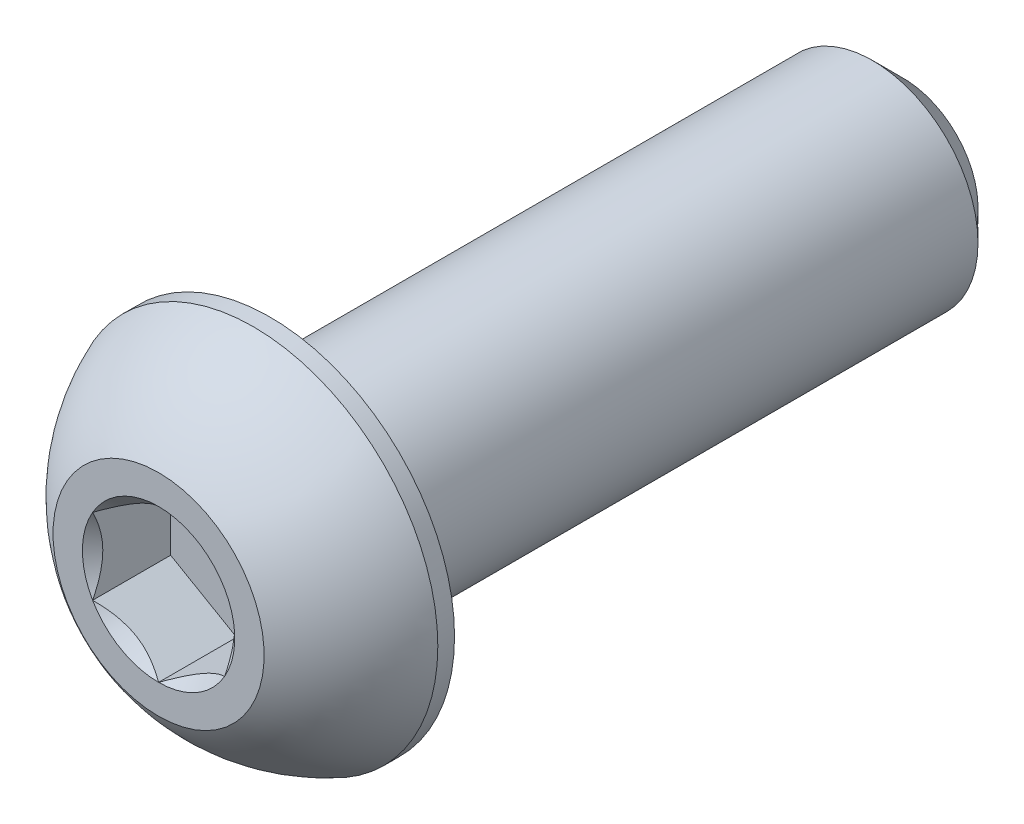
from build123d import *

# Parameters (mm, degrees)
SKETCH1_W          = 19.05
SKETCH1_H          = 3.175
CHAMFER1_SIZE      = 0.929268293
CUT_EXTRUDE2_DEPTH = 2.34696


with BuildPart() as part:
    # Sketch1 → Revolve1 (revolve)
    with BuildSketch(Plane(origin=(0, 0, 0), x_dir=(0, 0, -1), z_dir=(1, 0, 0))):
        with Locations((12.8778, 1.5875)):
            Rectangle(SKETCH1_W, SKETCH1_H)
    revolve(axis=Axis((0, 0, -22.4028), (0, 0, 1)))

    # Chamfer1
    chamfer1_edges = [part.edges().sort_by_distance(p)[0] for p in [
        (0, -3.175, -22.4028),
    ]]
    chamfer(chamfer1_edges, length=CHAMFER1_SIZE)

    # Sketch7 → Revolve2 (revolve)
    with BuildSketch(Plane(origin=(0, 0, 0), x_dir=(0, 0, -1), z_dir=(1, 0, 0))):
        with BuildLine():
            Line((2.84988, 5.5499), (3.3528, 5.5499))
            Line((3.3528, 5.5499), (3.3528, 0))
            Line((3.3528, 0), (0, 0))
            Line((0, 0), (0, 3.175))
            ThreePointArc((0, 3.175), (1.235921075, 4.58927271), (2.84988, 5.5499))
        make_face()
    revolve(axis=Axis((0, 0, 0), (0, 0, -1)))

    # Sketch5 → Cut-Extrude2 (cut)
    with BuildSketch(Plane.XY):
        Polygon((1.984375, -1.14567944), (1.984375, 1.14567944), (0, 2.291358881), (-1.984375, 1.14567944), (-1.984375, -1.14567944), (0, -2.291358881), align=None)
    extrude(amount=-CUT_EXTRUDE2_DEPTH, mode=Mode.SUBTRACT)

    # Cut-Extrude3 cone 1 section (through the dimple's axis) → Cut-Extrude3 (revolve, cut)
    with BuildSketch(Plane(origin=(0, 0, 0), x_dir=(0, -1, 0), z_dir=(1, 0, 0))):
        Polygon((0, 0), (2.291358881, 0), (0, 2.291358881), align=None)
    revolve(axis=Axis((0, 0, 0), (0, 0, -1)), mode=Mode.SUBTRACT)


solid = part.part
